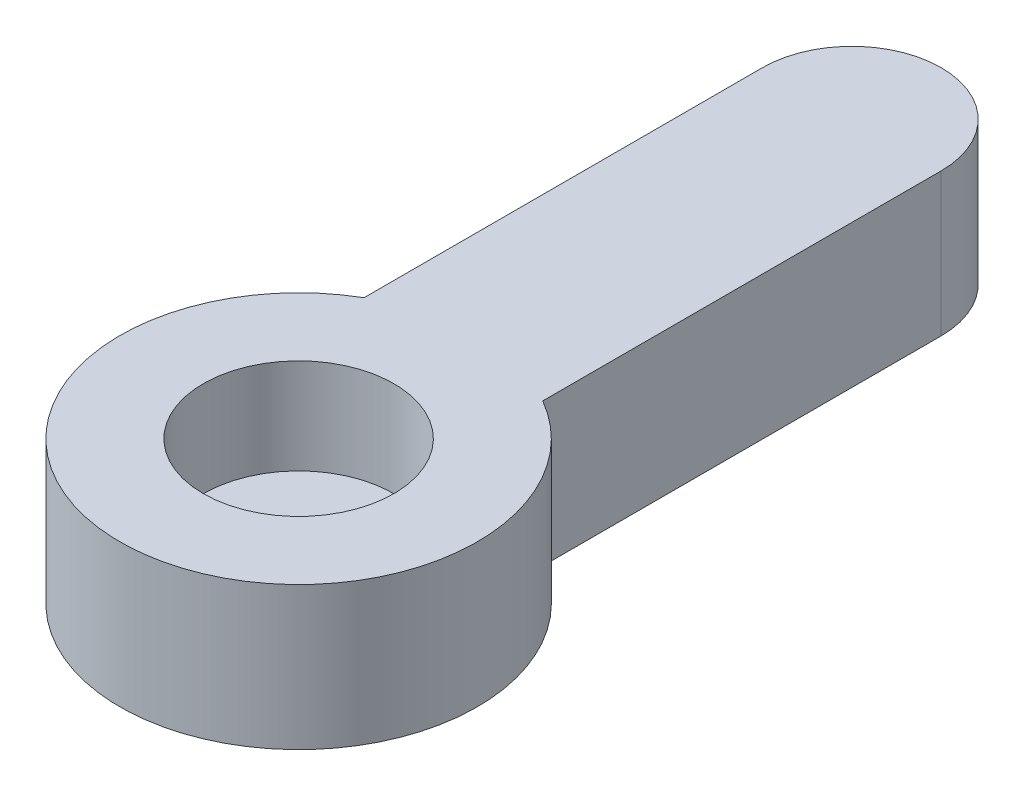
from build123d import *

# Parameters (mm, degrees)
BOSS_EXTRUDE1_DEPTH = 6
SKETCH3_R           = 4
CUT_EXTRUDE1_DEPTH  = 4


with BuildPart() as part:
    # Sketch1 → Boss-Extrude1 (new body)
    with BuildSketch(Plane(origin=(0, 0, 0), x_dir=(1, 0, 0), z_dir=(0, 1, 0))):
        with BuildLine():
            Line((-3.75, 13.995190528), (-3.75, 30.718752222))
            ThreePointArc((-3.75, 30.718752222), (0, 34.468752222), (3.75, 30.718752222))
            Line((3.75, 30.718752222), (3.75, 13.995190528))
            ThreePointArc((3.75, 13.995190528), (0, 0), (-3.75, 13.995190528))
        make_face()
    extrude(amount=BOSS_EXTRUDE1_DEPTH)

    # Sketch3 → Cut-Extrude1 (cut)
    with BuildSketch(Plane(origin=(0, 6, 0), x_dir=(1, 0, 0), z_dir=(0, 1, 0))):
        with Locations(Location((0, 7.500347692, 0), (0, 0, 270))):
            Circle(SKETCH3_R)
    extrude(amount=-CUT_EXTRUDE1_DEPTH, mode=Mode.SUBTRACT)


solid = part.part
